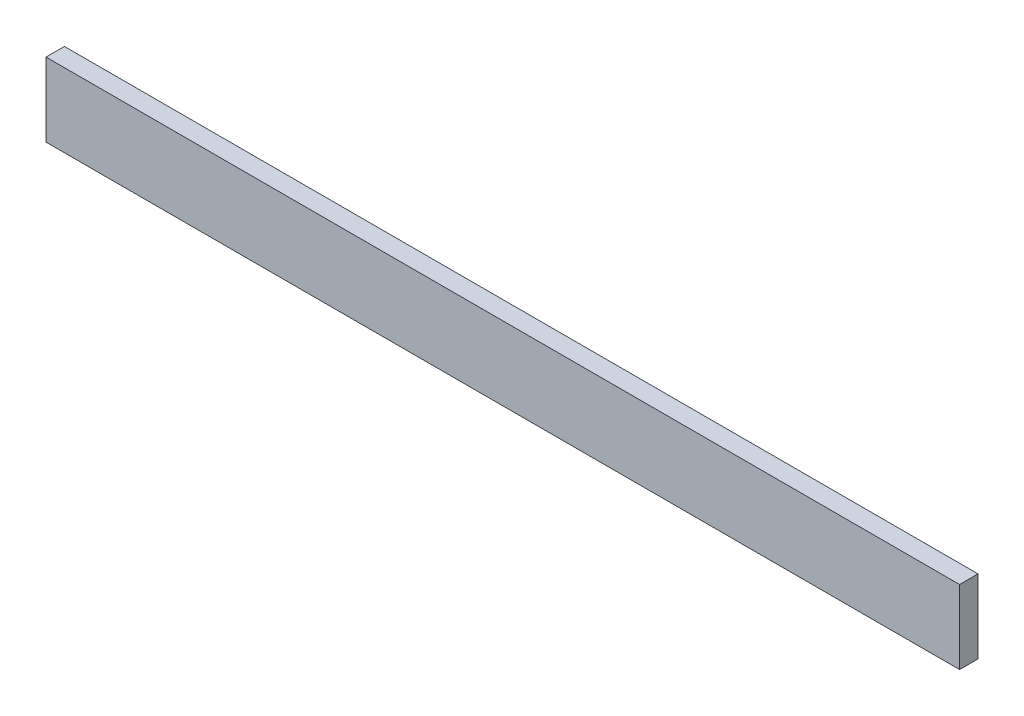
from build123d import *

# Parameters (mm, degrees)
BOSS_EXTRUDE1_DEPTH = 1.5875


with BuildPart() as part:
    # Sketch2 → Boss-Extrude1 (new body)
    with BuildSketch(Plane(origin=(-2e-09, 0, -0.000762245), x_dir=(0.9999999999955576, 0, -2.980747777482813e-06), z_dir=(2.980747777482813e-06, 0, 0.9999999999955576))):
        Polygon((-295.456298149, 0.792732058), (-295.456298149, -5.557267942), (-216.715150129, -5.557057567), (-216.715150129, 0.792942433), align=None)
    extrude(amount=BOSS_EXTRUDE1_DEPTH)


solid = part.part
